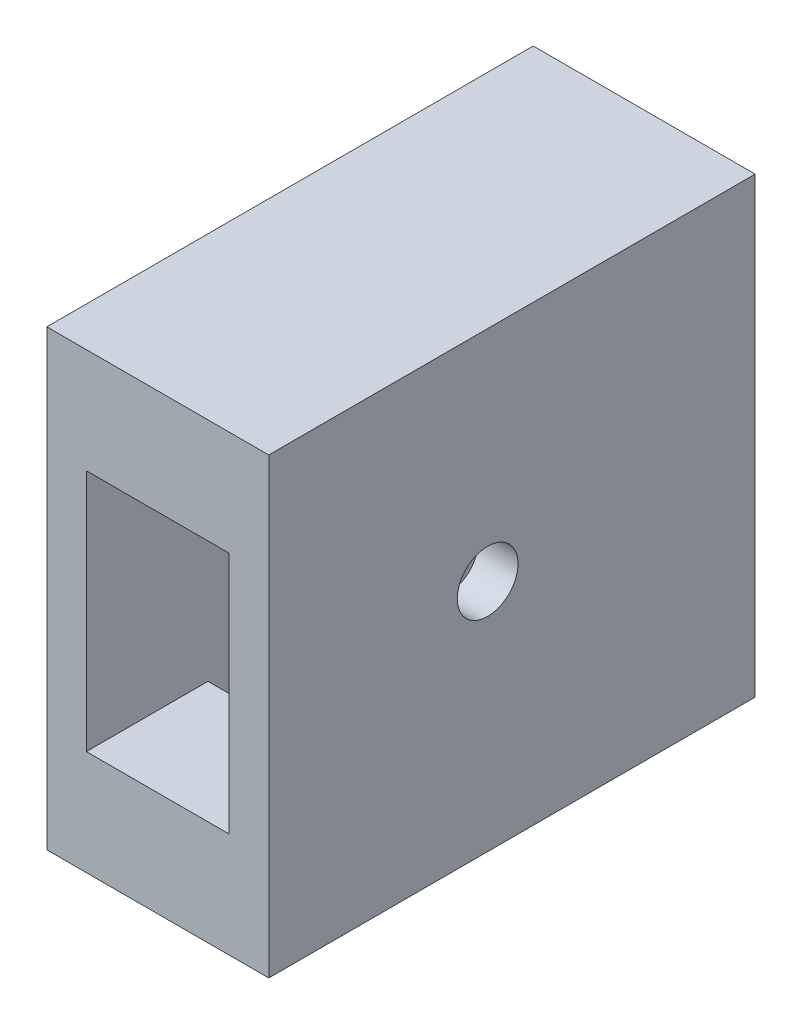
from build123d import *

# Parameters (mm, degrees)
SKETCH1_W           = 7.3
SKETCH1_H           = 14.9
SKETCH1_W_2         = 4.7
SKETCH1_H_2         = 12.3
BOSS_EXTRUDE1_DEPTH = 16
BOSS_EXTRUDE2_START = 12
SKETCH4_W           = 4.7
SKETCH4_H           = 2.15
BOSS_EXTRUDE2_DEPTH = 4
SKETCH5_R           = 1
CUT_EXTRUDE1_DEPTH  = 15


with BuildPart() as part:
    # Sketch1 → Boss-Extrude1 (new body)
    with BuildSketch(Plane.XY):
        with Locations((2.35, 6.15)):
            Rectangle(SKETCH1_W, SKETCH1_H)
        with Locations((2.35, 6.15)):
            Rectangle(SKETCH1_W_2, SKETCH1_H_2, mode=Mode.SUBTRACT)
    extrude(amount=BOSS_EXTRUDE1_DEPTH)

    # Sketch4 → Boss-Extrude2 (add)
    with BuildSketch(Plane.XY.offset(BOSS_EXTRUDE2_START)):
        with Locations((2.35, 1.075)):
            Rectangle(SKETCH4_W, SKETCH4_H)
        with Locations((2.35, 11.225)):
            Rectangle(SKETCH4_W, SKETCH4_H)
    extrude(amount=BOSS_EXTRUDE2_DEPTH)

    # Sketch5 → Cut-Extrude1 (cut)
    with BuildSketch(Plane.ZY.offset(1.3)):
        with Locations((8.8, 6.4)):
            Circle(SKETCH5_R)
    extrude(amount=-CUT_EXTRUDE1_DEPTH, mode=Mode.SUBTRACT)


solid = part.part
